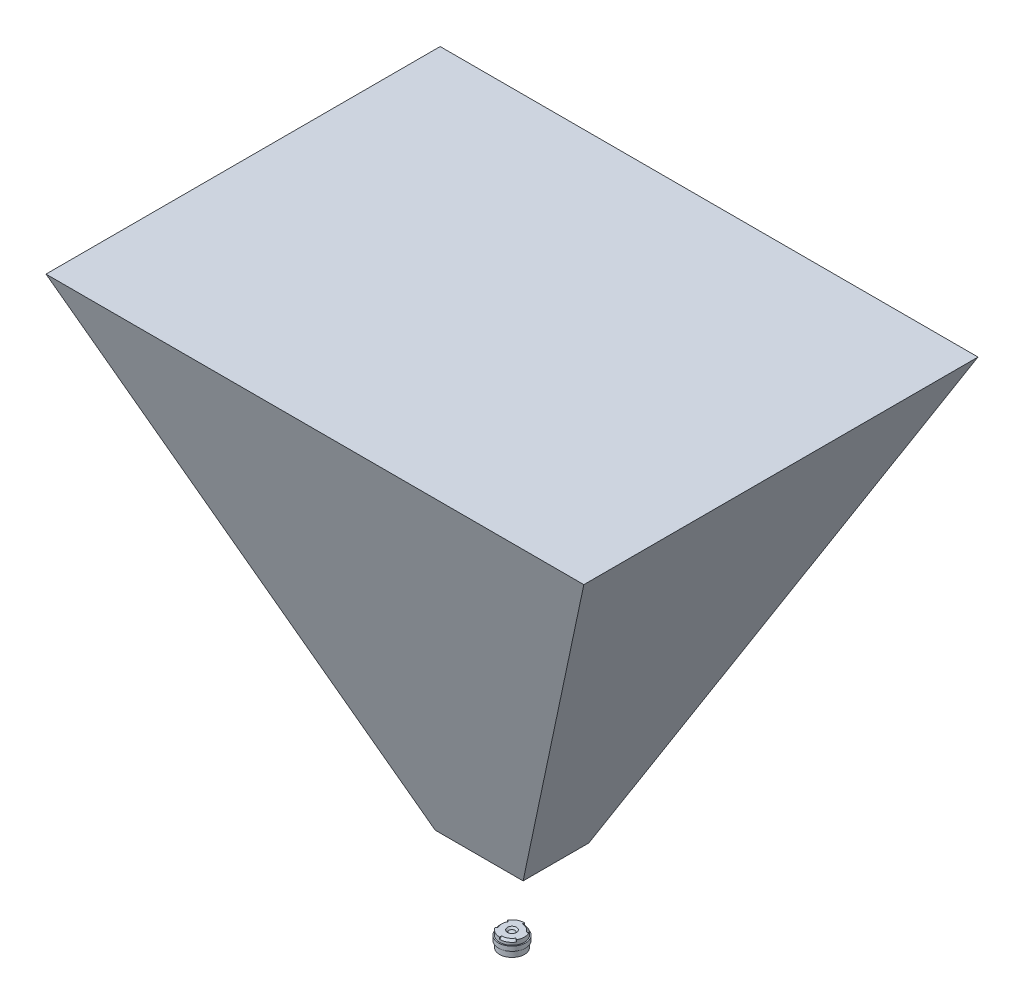
from build123d import *

# Parameters (mm, degrees)
SKIZZE4_W             = 0.25
SKIZZE4_H             = 1
TOOLFACE_ANGLE        = 60
KREISMUSTER1_COUNT    = 3
FOV_3_6MM_F_2_9_DEPTH = 100
FOV2_DEPTH            = 162.242607495
FOV2_DEPTH_BACK       = 162.242607495
SKIZZE8_OUTSIDE_W     = 251.934
SKIZZE8_OUTSIDE_H     = 173.192
SKIZZE8_OUTSIDE_R     = 5


with BuildPart() as part:
    # Skizze3 → Body (revolve)
    with BuildSketch(Plane.XY, mode=Mode.PRIVATE) as body_sk:
        with BuildLine():
            Line((1, 0.8), (2.75, 0.8))
            Line((2.75, 0.8), (2.75, -2.55))
            Line((2.75, -2.55), (2.1, -2.55))
            Line((2.1, -2.55), (1.8, -2.25))
            ThreePointArc((1.8, -2.25), (0.91241438, -2.474486277), (0, -2.55))
            Line((0, -2.55), (0, 0.525))
            ThreePointArc((0, 0.525), (0.316474723, 0.499842016), (0.625, 0.425))
            Line((0.625, 0.425), (1, 0.8))
        make_face()
    revolve(body_sk.sketch.rotate(Axis((0, 0, 0), (0, -1, 0)), 90), axis=Axis((0, 0, 0), (0, -1, 0)))

    # Skizze4 → Thread (revolve)
    with BuildSketch(Plane.XY):
        with Locations((2.875, -0.7)):
            Rectangle(SKIZZE4_W, SKIZZE4_H)
    revolve(axis=Axis((0, 0, 0), (0, 1, 0)))

    # Skizze5 → Toolface (revolve, cut)
    with BuildSketch(Plane(origin=(0, 0, 0), x_dir=(0, 0, -1), z_dir=(1, 0, 0))):
        Polygon((2.75, 0.8), (2.75, 0.35), (2.3, 0.8), align=None)
    toolface = revolve(axis=Axis((0, 0, 0), (0, -1, 0)), revolution_arc=TOOLFACE_ANGLE, mode=Mode.SUBTRACT)

    # Kreismuster1: Toolface ×3 about axis
    kreismuster1_axis = Axis((0, 0, 0), (0, 1, 0))
    for i in range(1, KREISMUSTER1_COUNT):
        add(toolface.rotate(kreismuster1_axis, i * 360 / KREISMUSTER1_COUNT), mode=Mode.SUBTRACT)


with BuildPart() as body_2:
    # Skizze6 → FOV - 3,6mm f/2,9 (new, symmetric)
    with BuildSketch(Plane(origin=(0, 0, 0), x_dir=(0, 0, -1), z_dir=(1, 0, 0))):
        Polygon((-7.279404685, 18.707826613), (-43.676428112, 118.707826613), (43.676428112, 118.707826613), (7.279404685, 18.707826613), align=None)
    extrude(amount=FOV_3_6MM_F_2_9_DEPTH, both=True)

    # Skizze8 outside → FOV2 (cut, two sides: drawn at the far end of the back side and taken through both)
    with BuildSketch(Plane.XY.offset(-FOV2_DEPTH_BACK)):
        with Locations((0, 58.079)):
            Rectangle(SKIZZE8_OUTSIDE_W, SKIZZE8_OUTSIDE_H)
        Circle(SKIZZE8_OUTSIDE_R, mode=Mode.SUBTRACT)
        Polygon((-9.740481092, 18.707826613), (-59.598641898, 118.707826613), (59.598641898, 118.707826613), (9.740481092, 18.707826613), align=None, mode=Mode.SUBTRACT)
    extrude(amount=FOV2_DEPTH + FOV2_DEPTH_BACK, mode=Mode.SUBTRACT)


solid = Compound([part.part, body_2.part])
